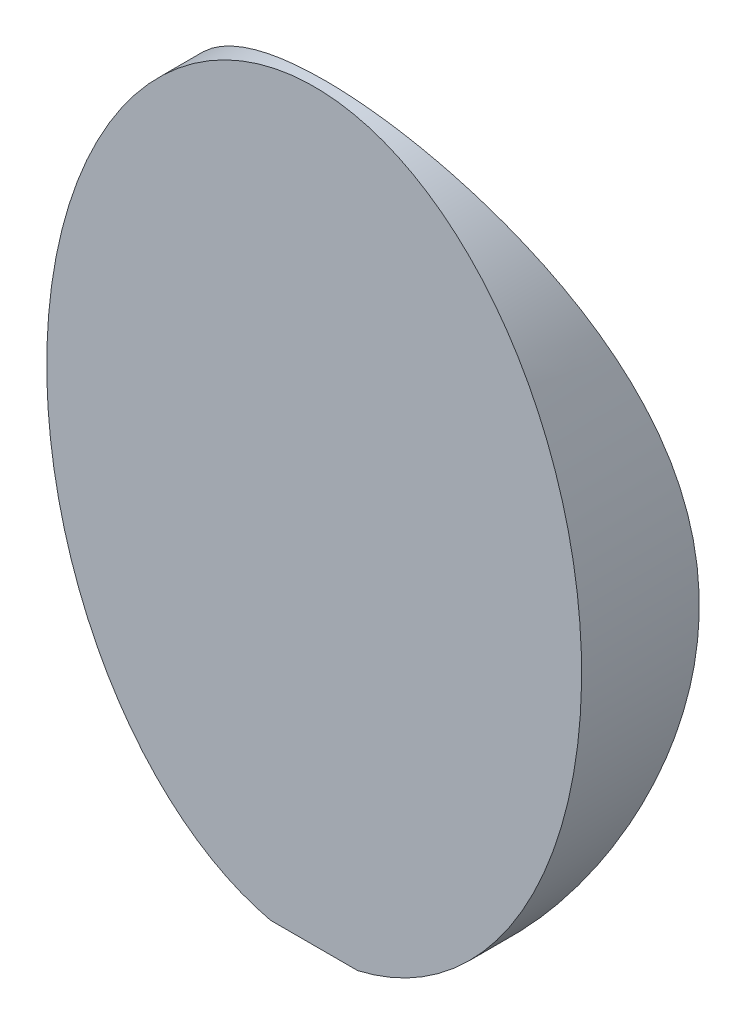
from build123d import *

# Parameters (mm, degrees)
BOSS_EXTRUDE1_DEPTH     = 0.4
CUT_EXTRUDE1_DEPTH      = 1.948683467
CUT_EXTRUDE1_DEPTH_BACK = 1.948683467


with BuildPart() as part:
    # Sketch1 → Boss-Extrude1 (new body)
    with BuildSketch(Plane.XY):
        with BuildLine():
            Line((-0.081490966, -0.690640338), (0.081490966, -0.690640338))
            add(Edge.make_bspline(
                [(0.081490966, -0.690640338), (0.837464392, -0.515808659), (0.418732196, 0.382544327), (0, 1.280897313), (-0.418732196, 0.382544327), (-0.837464392, -0.515808659), (-0.081490966, -0.690640338)],
                knots=[3.305304901, 3.305304901, 3.305304901, 5.290558505, 5.290558505, 7.275812109, 7.275812109, 9.261065714, 9.261065714, 9.261065714], degree=2, weights=[1, 0.546491895, 1, 0.546491895, 1, 0.546491895, 1]))
        make_face()
    extrude(amount=BOSS_EXTRUDE1_DEPTH)

    # Sketch2 → Cut-Extrude1 (cut, two sides: drawn at the far end of the back side and taken through both)
    with BuildSketch(Plane(origin=(0, 0, 0), x_dir=(1, 0, 0), z_dir=(0, 1, 0)).offset(-CUT_EXTRUDE1_DEPTH_BACK)):
        with BuildLine():
            Line((-0.5, -0.18), (-0.5, 0.037619397))
            Line((-0.5, 0.037619397), (0.5, 0.037619397))
            Line((0.5, 0.037619397), (0.5, -0.18))
            ThreePointArc((0.5, -0.18), (0, -0.38), (-0.5, -0.18))
        make_face()
    extrude(amount=CUT_EXTRUDE1_DEPTH + CUT_EXTRUDE1_DEPTH_BACK, mode=Mode.SUBTRACT)


solid = part.part
